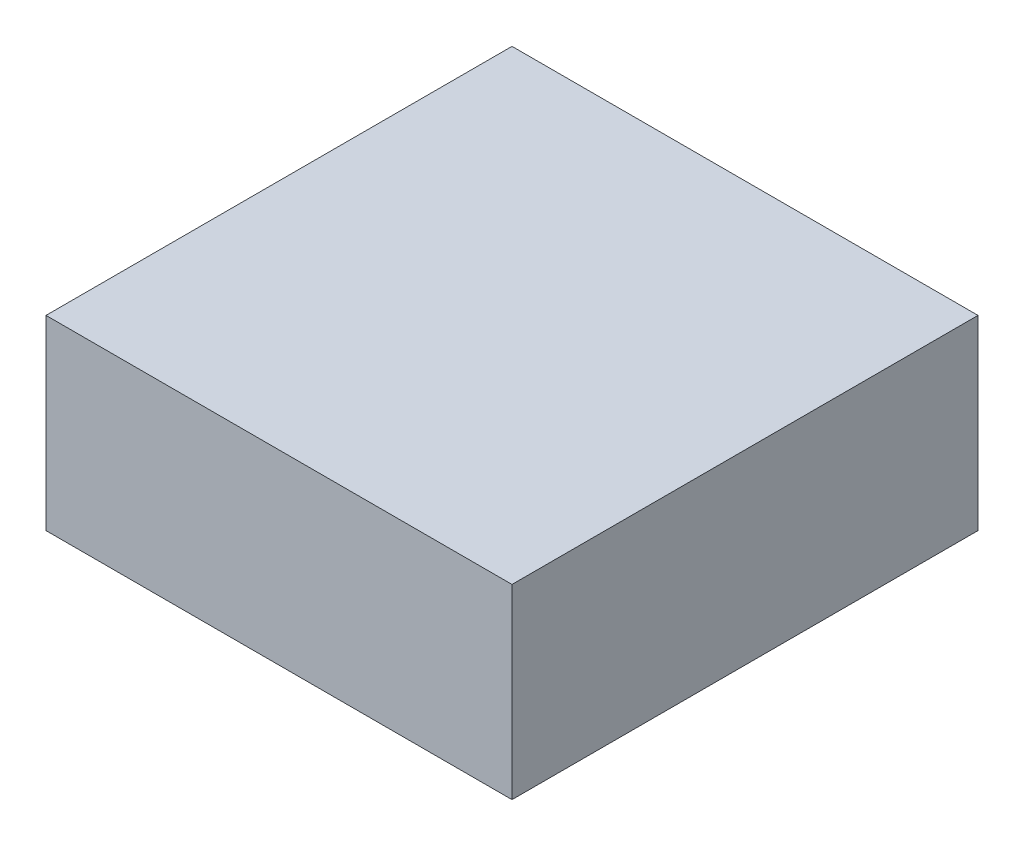
from build123d import *

# Parameters (mm, degrees)
IZIM1_W                     = 20
IZIM1_H                     = 20
Y_KSEKLIK_EKSTR_ZYON1_DEPTH = 8


with BuildPart() as part:
    # Çizim1 → Yükseklik-Ekstrüzyon1 (new body)
    with BuildSketch(Plane(origin=(0, 0, 0), x_dir=(1, 0, 0), z_dir=(0, 1, 0))):
        Rectangle(IZIM1_W, IZIM1_H)
    extrude(amount=Y_KSEKLIK_EKSTR_ZYON1_DEPTH)


solid = part.part
